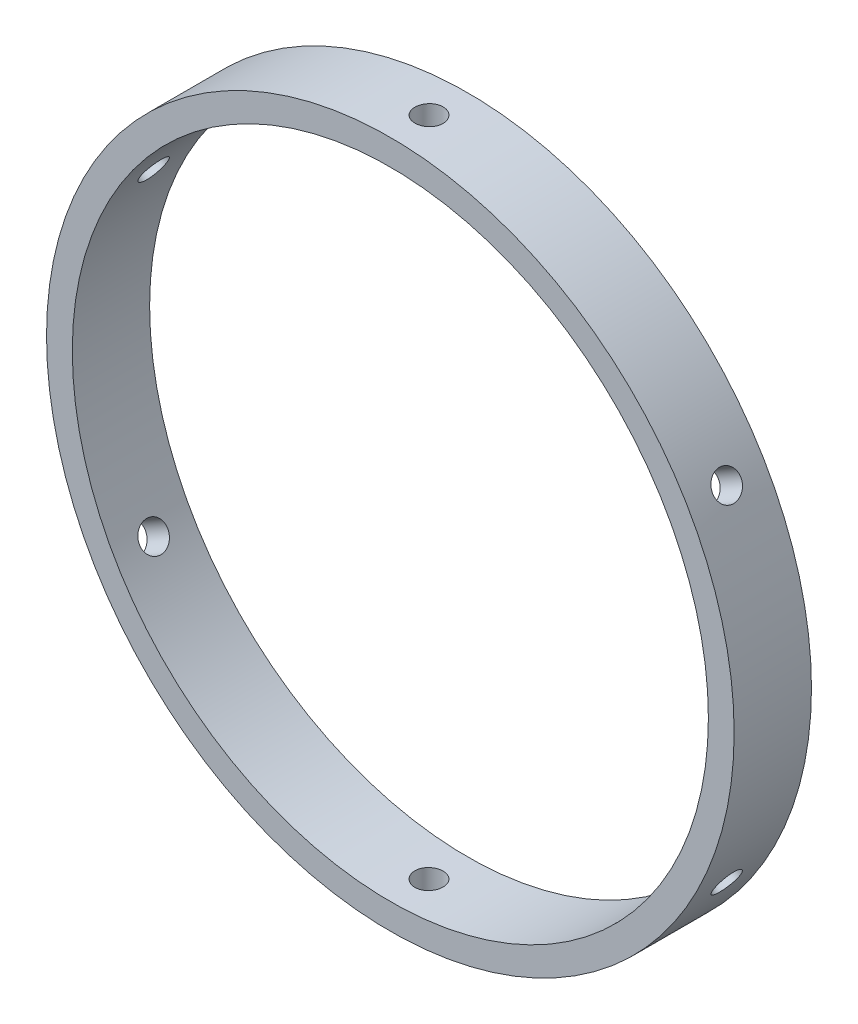
from build123d import *

# Parameters (mm, degrees)
SKETCH1_R           = 84.709
SKETCH1_R_2         = 78.359
BOSS_EXTRUDE1_DEPTH = 19.05
SKETCH2_R           = 3.478244762
CUT_EXTRUDE1_DEPTH  = 122.301821347
CIRPATTERN1_COUNT   = 6


with BuildPart() as part:
    # Sketch1 → Boss-Extrude1 (new body)
    with BuildSketch(Plane.XY):
        with Locations(Location((0, 0, 0), (0, 0, 180))):
            Circle(SKETCH1_R)
        with Locations(Location((0, 0, 0), (0, 0, 180))):
            Circle(SKETCH1_R_2, mode=Mode.SUBTRACT)
    extrude(amount=BOSS_EXTRUDE1_DEPTH)

    # Sketch2 → Cut-Extrude1 (cut, through all)
    with BuildSketch(Plane(origin=(0, 0, 0), x_dir=(1, 0, 0), z_dir=(0, 1, 0))):
        with Locations(Location((0, -9.525, 0), (0, 0, 270))):
            Circle(SKETCH2_R)
    cut_extrude1 = extrude(amount=-CUT_EXTRUDE1_DEPTH, mode=Mode.SUBTRACT)

    # CirPattern1: Cut-Extrude1 ×6 about axis
    cirpattern1_axis = Axis((0, 0, 2.080715754), (0, 0, 1))
    for i in range(1, CIRPATTERN1_COUNT):
        add(cut_extrude1.rotate(cirpattern1_axis, i * 360 / CIRPATTERN1_COUNT), mode=Mode.SUBTRACT)


solid = part.part
